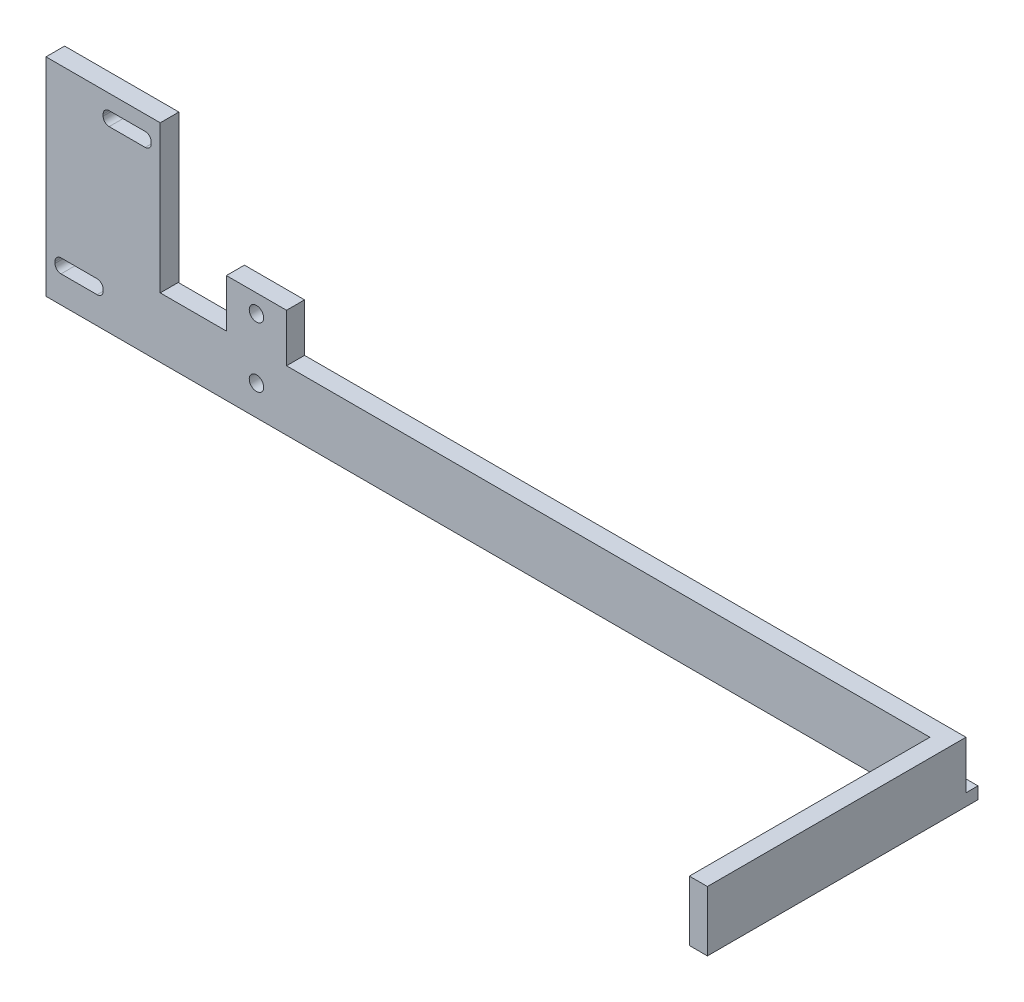
from build123d import *

# Parameters (mm, degrees)
EXTRUDE_1_DEPTH     = 10
SKETCH_2_W          = 10
SKETCH_2_H          = 18
EXTRUDE_2_DEPTH     = 3
SKETCH_3_R          = 1.2
CUT_EXTRUDE_1_DEPTH = 99.701570403
SKETCH_4_W          = 150
SKETCH_4_H          = 2
EXTRUDE_3_DEPTH     = 2
SKETCH_5_W          = 19
SKETCH_5_H          = 34.5
EXTRUDE_4_DEPTH     = 3.1
SKETCH_7_W          = 8
SKETCH_7_H          = 2.3
CUT_EXTRUDE_2_DEPTH = 10
FILLET_1_R          = 1


with BuildPart() as part:
    # Эскиз1 → Бобышка-Вытянуть1 (new body)
    with BuildSketch(Plane(origin=(0, 0, 0), x_dir=(1, 0, 0), z_dir=(0, 1, 0))):
        Polygon((-87, 21.5), (-87, 18.5), (-60, 18.5), (60, 18.5), (60, -21.5), (63, -21.5), (63, 21.5), align=None)
    extrude(amount=EXTRUDE_1_DEPTH)

    # Эскиз2 → Бобышка-Вытянуть2 (add)
    with BuildSketch(Plane(origin=(0, 0, -21.5), x_dir=(-1, 0, 0), z_dir=(0, 0, -1))):
        with Locations((52, 9)):
            Rectangle(SKETCH_2_W, SKETCH_2_H)
    extrude(amount=-EXTRUDE_2_DEPTH)

    # Эскиз3 → Вырез-Вытянуть1 (cut, through all)
    with BuildSketch(Plane(origin=(0, 0, -21.5), x_dir=(-1, 0, 0), z_dir=(0, 0, -1))):
        with Locations((52, 15)):
            Circle(SKETCH_3_R)
        with Locations((52, 5)):
            Circle(SKETCH_3_R)
    extrude(amount=-CUT_EXTRUDE_1_DEPTH, mode=Mode.SUBTRACT)

    # Эскиз4 → Бобышка-Вытянуть3 (add)
    with BuildSketch(Plane(origin=(0, 0, -21.5), x_dir=(-1, 0, 0), z_dir=(0, 0, -1))):
        with Locations((12, 1)):
            Rectangle(SKETCH_4_W, SKETCH_4_H)
    extrude(amount=EXTRUDE_3_DEPTH)

    # Эскиз5 → Бобышка-Вытянуть4 (add)
    with BuildSketch(Plane.XY.offset(-18.5)):
        with Locations((-77.5, 17.25)):
            Rectangle(SKETCH_5_W, SKETCH_5_H)
    extrude(amount=-EXTRUDE_4_DEPTH)

    # Эскиз7 → Вырез-Вытянуть2 (cut)
    with BuildSketch(Plane.XY.offset(-18.5)):
        with Locations((-73.5, 30.850007469)):
            Rectangle(SKETCH_7_W, SKETCH_7_H)
        with Locations((-81.5, 5.639796257)):
            Rectangle(SKETCH_7_W, SKETCH_7_H)
    extrude(amount=-CUT_EXTRUDE_2_DEPTH, mode=Mode.SUBTRACT)

    # Скругление1
    fillet_1_edges = [part.edges().sort_by_distance(p)[0] for p in [
        (-85.5, 4.489796257, -20.05),
        (-85.5, 6.789796257, -20.05),
        (-77.5, 6.789796257, -20.05),
        (-77.5, 4.489796257, -20.05),
        (-69.5, 32.000007469, -20.05),
        (-69.5, 29.700007469, -20.05),
        (-77.5, 29.700007469, -20.05),
        (-77.5, 32.000007469, -20.05),
    ]]
    fillet(fillet_1_edges, radius=FILLET_1_R)


solid = part.part
